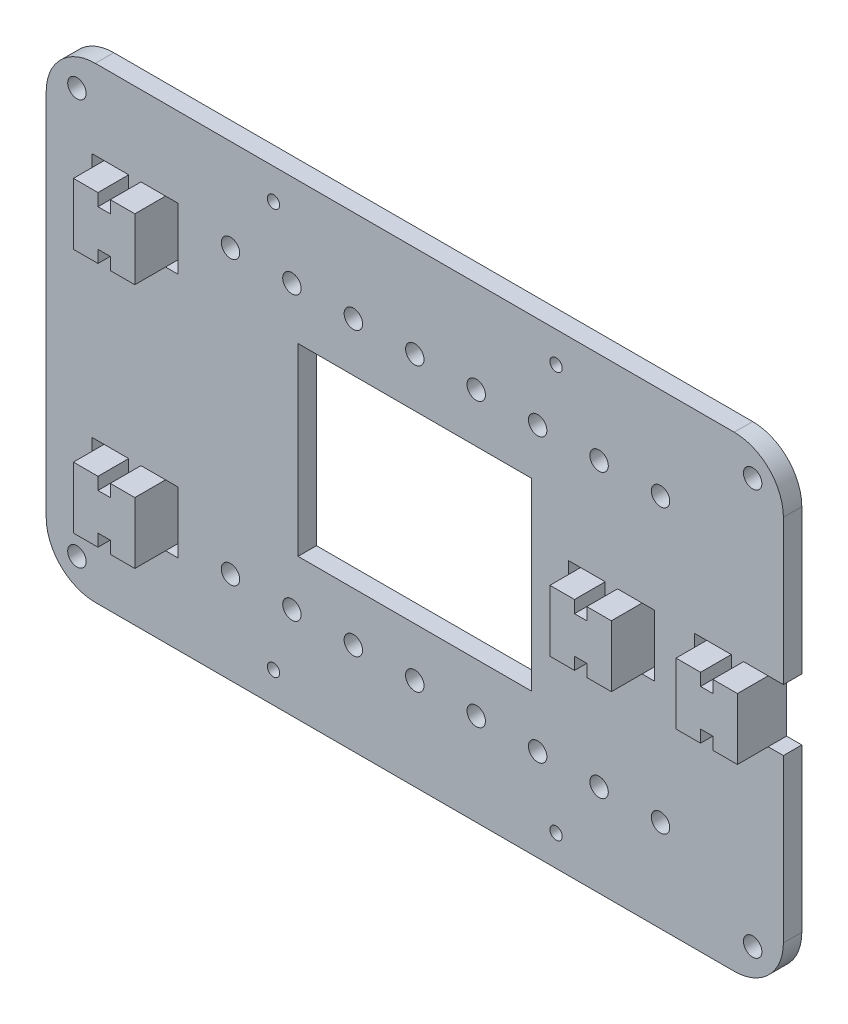
from build123d import *

# Parameters (mm, degrees)
SKETCH_2_W          = 120
SKETCH_2_H          = 76
SKETCH_2_R          = 1
EXTRUDE_2_DEPTH     = 3
SKETCH_3_W          = 38
SKETCH_3_H          = 30
CUT_EXTRUDE_1_DEPTH = 3
EXTRUDE_3_DEPTH     = 5
SKETCH_7_W          = 2
SKETCH_7_H          = 10
SKETCH_7_W_2        = 3
CUT_EXTRUDE_2_DEPTH = 5
SKETCH_9_R          = 1.5
CUT_EXTRUDE_3_DEPTH = 5
FILLET_1_R          = 8
SKETCH_10_R         = 1.5
CUT_EXTRUDE_4_DEPTH = 5


with BuildPart() as part:
    # 草图2 → 凸台-拉伸2 (new body)
    with BuildSketch(Plane.XY):
        Rectangle(SKETCH_2_W, SKETCH_2_H)
        with Locations((-23, 33)):
            Circle(SKETCH_2_R, mode=Mode.SUBTRACT)
        with Locations(Location((23, 33, 0), (0, 0, 180))):
            Circle(SKETCH_2_R, mode=Mode.SUBTRACT)
        with Locations((23, -33)):
            Circle(SKETCH_2_R, mode=Mode.SUBTRACT)
        with Locations(Location((-23, -33, 0), (0, 0, 180))):
            Circle(SKETCH_2_R, mode=Mode.SUBTRACT)
    extrude(amount=EXTRUDE_2_DEPTH)

    # 草图3 → 切除-拉伸1 (cut)
    with BuildSketch(Plane.XY.offset(3)):
        Rectangle(SKETCH_3_W, SKETCH_3_H)
    extrude(amount=-CUT_EXTRUDE_1_DEPTH, mode=Mode.SUBTRACT)

    # 草图6 → 凸台-拉伸3 (add)
    with BuildSketch(Plane.XY.offset(3)):
        Polygon((-50.570869285, 25), (-50.570869285, 15), (-46.570869285, 15), (-46.570869285, 17), (-44.570869285, 17), (-44.570869285, 15), (-40.570869285, 15), (-40.570869285, 25), (-44.570869285, 25), (-44.570869285, 23), (-46.570869285, 23), (-46.570869285, 25), align=None)
        Polygon((-50.570869285, -15), (-50.570869285, -25), (-46.570869285, -25), (-46.570869285, -23), (-44.570869285, -23), (-44.570869285, -25), (-40.570869285, -25), (-40.570869285, -15), (-44.570869285, -15), (-44.570869285, -17), (-46.570869285, -17), (-46.570869285, -15), align=None)
        Polygon((31, -1.582947544), (33, -1.582947544), (33, -3.582947544), (37, -3.582947544), (37, 6.417052456), (33, 6.417052456), (33, 4.417052456), (31, 4.417052456), (31, 6.417052456), (27, 6.417052456), (27, -3.582947544), (31, -3.582947544), align=None)
        Polygon((53.519832093, 6.417052456), (53.519832093, 4.417052456), (51.519832093, 4.417052456), (51.519832093, 6.417052456), (47.519832093, 6.417052456), (47.519832093, -3.582947544), (51.519832093, -3.582947544), (51.519832093, -1.582947544), (53.519832093, -1.582947544), (53.519832093, -3.582947544), (57.519832093, -3.582947544), (57.519832093, 6.417052456), align=None)
    extrude(amount=EXTRUDE_3_DEPTH)

    # 草图7 → 切除-拉伸2 (cut)
    with BuildSketch(Plane.XY.offset(3)):
        with Locations((-51.570869285, 20)):
            Rectangle(SKETCH_7_W, SKETCH_7_H)
        with Locations((-39.570869285, 20)):
            Rectangle(SKETCH_7_W, SKETCH_7_H)
        with Locations((-51.570869285, -20)):
            Rectangle(SKETCH_7_W, SKETCH_7_H)
        with Locations((-39.570869285, -20)):
            Rectangle(SKETCH_7_W, SKETCH_7_H)
        with Locations((26, 1.417052456)):
            Rectangle(SKETCH_7_W, SKETCH_7_H)
        with Locations((38, 1.417052456)):
            Rectangle(SKETCH_7_W, SKETCH_7_H)
        with Locations((46.519832093, 1.417052456)):
            Rectangle(SKETCH_7_W, SKETCH_7_H)
        with Locations((59.019832093, 1.417052456)):
            Rectangle(SKETCH_7_W_2, SKETCH_7_H)
    extrude(amount=-CUT_EXTRUDE_2_DEPTH, mode=Mode.SUBTRACT)

    # 草图9 → 切除-拉伸3 (cut)
    with BuildSketch(Plane.XY.offset(3)):
        with Locations((0, -23)):
            Circle(SKETCH_9_R)
        with Locations((10, -23)):
            Circle(SKETCH_9_R)
        with Locations((20, -23)):
            Circle(SKETCH_9_R)
        with Locations((30, -23)):
            Circle(SKETCH_9_R)
        with Locations((40, -23)):
            Circle(SKETCH_9_R)
        with Locations((-30, -23)):
            Circle(SKETCH_9_R)
        with Locations((-20, -23)):
            Circle(SKETCH_9_R)
        with Locations((-10, -23)):
            Circle(SKETCH_9_R)
        with Locations((-10, 23)):
            Circle(SKETCH_9_R)
        with Locations((-20, 23)):
            Circle(SKETCH_9_R)
        with Locations((-30, 23)):
            Circle(SKETCH_9_R)
        with Locations((40, 23)):
            Circle(SKETCH_9_R)
        with Locations((30, 23)):
            Circle(SKETCH_9_R)
        with Locations((20, 23)):
            Circle(SKETCH_9_R)
        with Locations((10, 23)):
            Circle(SKETCH_9_R)
        with Locations((0, 23)):
            Circle(SKETCH_9_R)
    extrude(amount=-CUT_EXTRUDE_3_DEPTH, mode=Mode.SUBTRACT)

    # 圆角1
    fillet_1_edges = [part.edges().sort_by_distance(p)[0] for p in [
        (60, -38, 1.5),
        (-60, -38, 1.5),
        (-60, 38, 1.5),
        (60, 38, 1.5),
    ]]
    fillet(fillet_1_edges, radius=FILLET_1_R)

    # 草图10 → 切除-拉伸4 (cut)
    with BuildSketch(Plane.XY.offset(3)):
        with Locations((-55, 33)):
            Circle(SKETCH_10_R)
        with Locations((55, 33)):
            Circle(SKETCH_10_R)
        with Locations((55, -33)):
            Circle(SKETCH_10_R)
        with Locations((-55, -33)):
            Circle(SKETCH_10_R)
    extrude(amount=-CUT_EXTRUDE_4_DEPTH, mode=Mode.SUBTRACT)


solid = part.part
